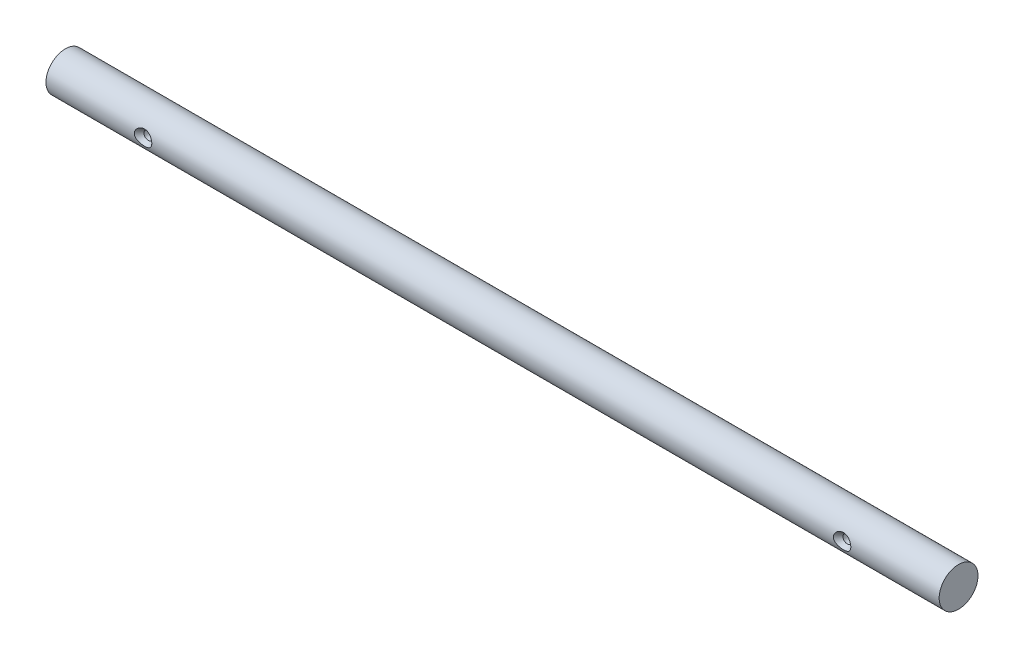
from build123d import *

# Parameters (mm, degrees)
SKETCH1_W                                         = 292.1
SKETCH1_H                                         = 6.35
CSK_FOR_4_FLAT_HEAD_MACHINE_SCREW_100_D           = 2.77876
CSK_FOR_4_FLAT_HEAD_MACHINE_SCREW_100_CSINK_D     = 5.715
CSK_FOR_4_FLAT_HEAD_MACHINE_SCREW_100_CSINK_ANGLE = 82


with BuildPart() as part:
    # Sketch1 → Revolve1 (revolve)
    with BuildSketch(Plane.XY):
        with Locations((146.05, 3.175)):
            Rectangle(SKETCH1_W, SKETCH1_H)
    revolve(axis=Axis((292.1, 0, 0), (-1, 0, 0)))

    # CSK for #4 Flat Head Machine Screw (100)1 (through all)
    with Locations(Plane.XY.offset(6.35)):
        with Locations((31.75, 0), (260.35, 0)):
            CounterSinkHole(CSK_FOR_4_FLAT_HEAD_MACHINE_SCREW_100_D / 2, CSK_FOR_4_FLAT_HEAD_MACHINE_SCREW_100_CSINK_D / 2, counter_sink_angle=CSK_FOR_4_FLAT_HEAD_MACHINE_SCREW_100_CSINK_ANGLE)


solid = part.part
